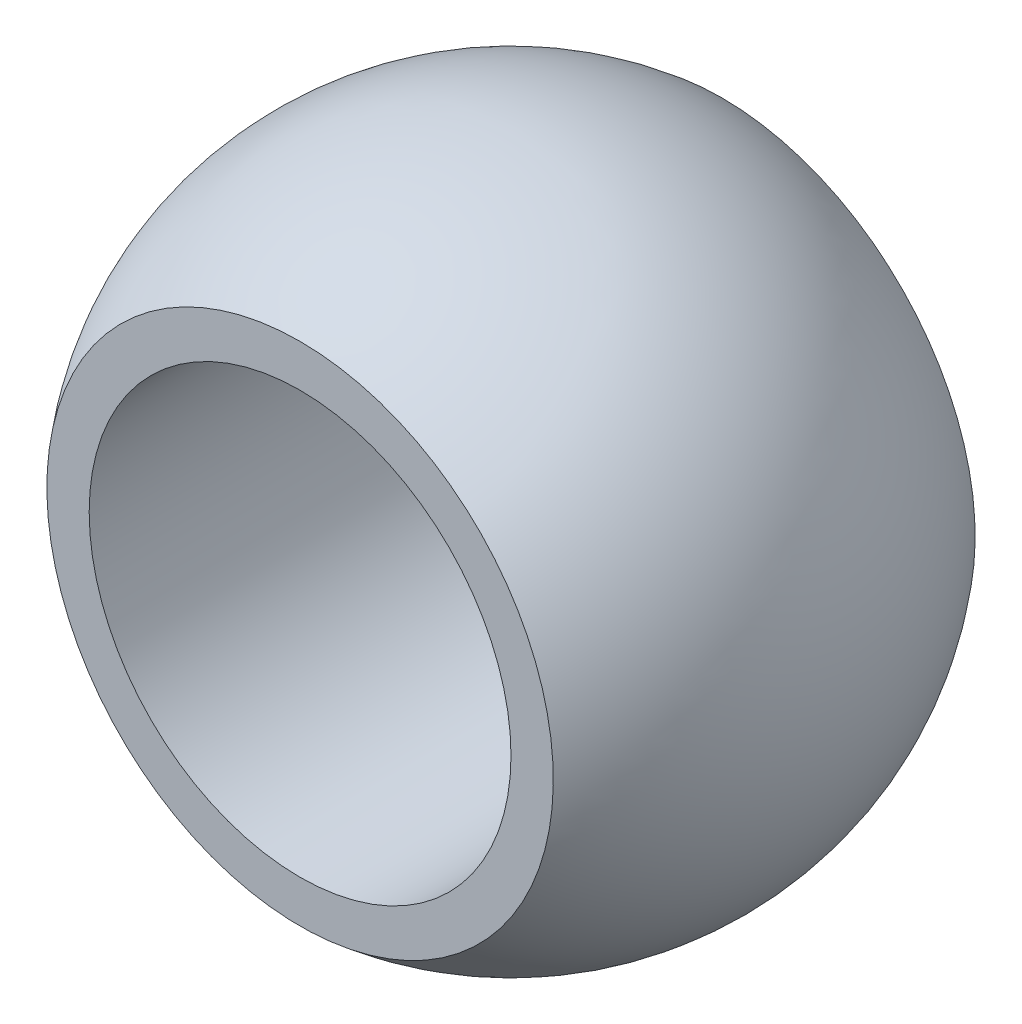
from build123d import *


with BuildPart() as part:
    # Sketch2 → Revolve1 (revolve)
    with BuildSketch(Plane(origin=(0, 0, 0), x_dir=(0, 0, -1), z_dir=(1, 0, 0)), mode=Mode.PRIVATE) as revolve1_sk:
        with BuildLine():
            Line((-4, 4), (4, 4))
            Line((4, 4), (4, 4.802343178))
            ThreePointArc((4, 4.802343178), (0, 6.25), (-4, 4.802343178))
            Line((-4, 4.802343178), (-4, 4))
        make_face()
    revolve(revolve1_sk.sketch.rotate(Axis((0, 0, 4), (0, 0, -1)), 90), axis=Axis((0, 0, 4), (0, 0, -1)))


solid = part.part
